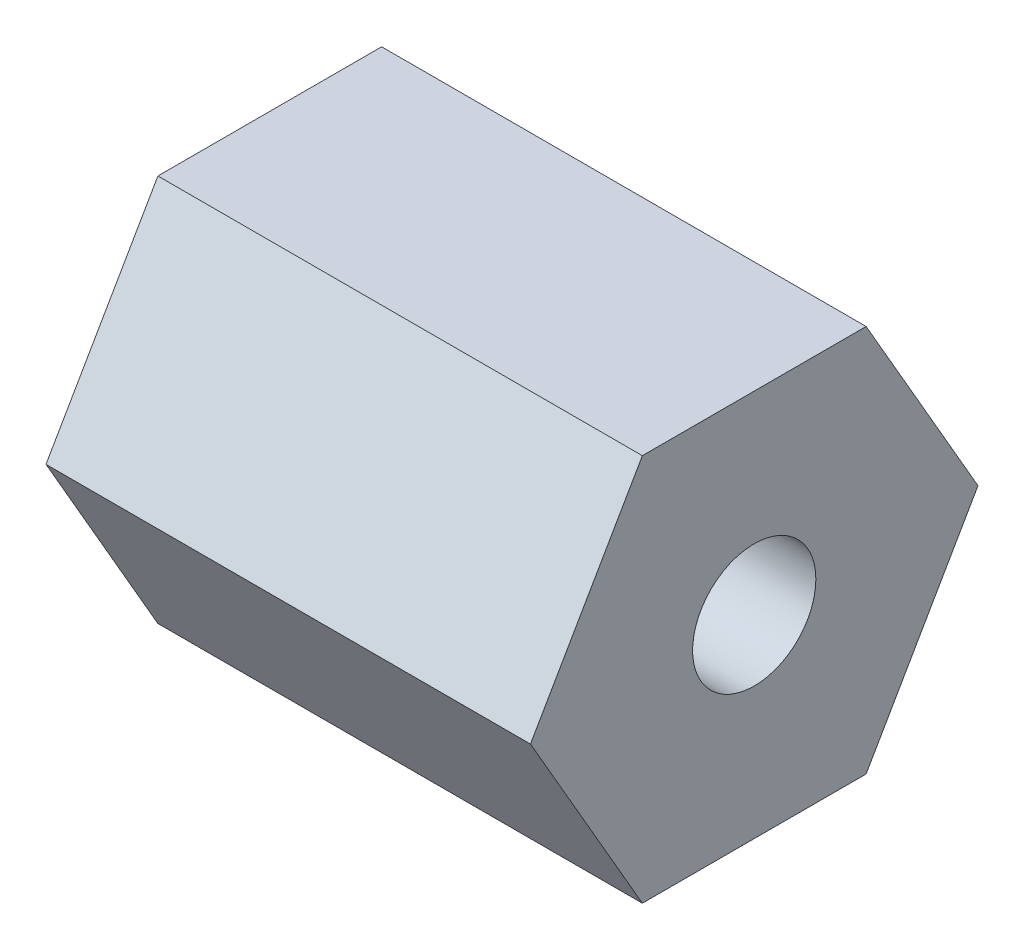
from build123d import *

# Parameters (mm, degrees)
BOSS_EXTRUDE1_DEPTH                  = 7.9375
F_10_32_TAPPED_HOLE1_D               = 4.0386
F_10_32_TAPPED_HOLE1_DEPTH           = 16.256
F_10_32_TAPPED_HOLE1_TIP             = 1.213317848
F_10_32_TAPPED_HOLE1_ON_FACE_2_D     = 4.0386
F_10_32_TAPPED_HOLE1_ON_FACE_2_DEPTH = 16.256
F_10_32_TAPPED_HOLE1_ON_FACE_2_TIP   = 1.213317848


with BuildPart() as part:
    # Sketch1 → Boss-Extrude1 (new, symmetric)
    with BuildSketch(Plane(origin=(0, 0, 0), x_dir=(0, 0, -1), z_dir=(1, 0, 0))):
        Polygon((7.332348419, 0), (3.666174209, 6.35), (-3.666174209, 6.35), (-7.332348419, 0), (-3.666174209, -6.35), (3.666174209, -6.35), align=None)
    extrude(amount=BOSS_EXTRUDE1_DEPTH, both=True)

    # #10-32 Tapped Hole1
    with Locations(Plane(origin=(7.9375, 0, 0), x_dir=(0, 0, 1), z_dir=(1, 0, 0))):
        with Locations((0, 0)):
            Hole(F_10_32_TAPPED_HOLE1_D / 2, depth=F_10_32_TAPPED_HOLE1_DEPTH)
            with Locations((0, 0, -(F_10_32_TAPPED_HOLE1_DEPTH + F_10_32_TAPPED_HOLE1_TIP / 2))):  # 118° drill point
                Cone(0, F_10_32_TAPPED_HOLE1_D / 2, F_10_32_TAPPED_HOLE1_TIP, mode=Mode.SUBTRACT)

    # #10-32 Tapped Hole1 on face 2
    with Locations(Plane(origin=(0, 0, 0), x_dir=(0, 0, 1), z_dir=(1, 0, 0))):
        with Locations((0, 0)):
            Hole(F_10_32_TAPPED_HOLE1_ON_FACE_2_D / 2, depth=F_10_32_TAPPED_HOLE1_ON_FACE_2_DEPTH)
            with Locations((0, 0, -(F_10_32_TAPPED_HOLE1_ON_FACE_2_DEPTH + F_10_32_TAPPED_HOLE1_ON_FACE_2_TIP / 2))):  # 118° drill point
                Cone(0, F_10_32_TAPPED_HOLE1_ON_FACE_2_D / 2, F_10_32_TAPPED_HOLE1_ON_FACE_2_TIP, mode=Mode.SUBTRACT)


solid = part.part
